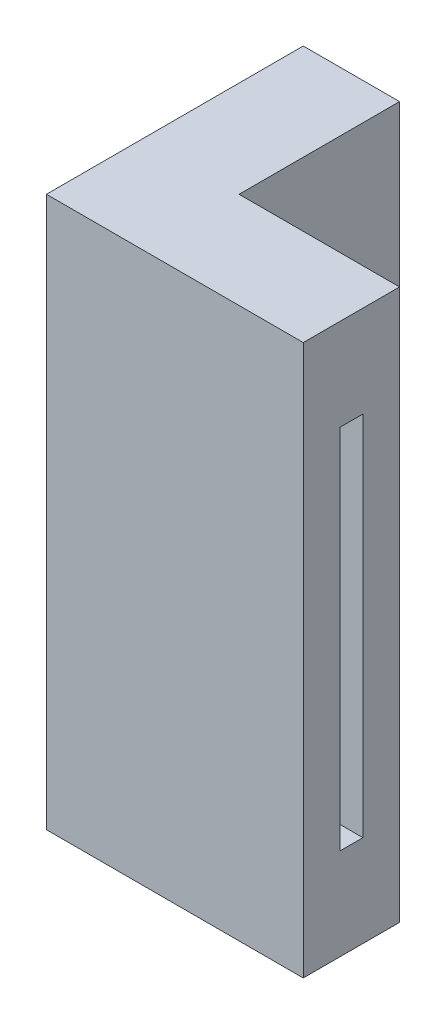
from build123d import *

# Parameters (mm, degrees)
BOSS_EXTRUDE2_DEPTH   = 76.2
BOSS_EXTRUDE2_2_DEPTH = 76.2
BOSS_EXTRUDE3_DEPTH   = 12.7
BOSS_EXTRUDE4_DEPTH   = 12.7
SKETCH3_R             = 2.1
CUT_EXTRUDE1_DEPTH    = 6.35


with BuildPart() as part:
    # Sketch1 → Boss-Extrude2 (new body)
    with BuildSketch(Plane(origin=(0, 0, 0), x_dir=(1, 0, 0), z_dir=(0, 1, 0))):
        Polygon((30.48, 0), (0, 0), (0, 30.48), (-5.08, 30.48), (-5.08, -5.08), (30.48, -5.08), align=None)
    extrude(amount=BOSS_EXTRUDE2_DEPTH)



with BuildPart() as body_2:
    # Sketch1 → Boss-Extrude2 2 (new body)
    with BuildSketch(Plane(origin=(0, 0, 0), x_dir=(1, 0, 0), z_dir=(0, 1, 0))):
        Polygon((8.255, 30.48), (3.175, 30.48), (3.175, 3.175), (30.48, 3.175), (30.48, 8.255), (8.255, 8.255), align=None)
    extrude(amount=BOSS_EXTRUDE2_2_DEPTH)


with BuildPart() as part_1:
    add(part.part)

    add(body_2.part)  # Boss-Extrude3 merges body 2
    # Sketch1<5> → Boss-Extrude3 (add)
    with BuildSketch(Plane(origin=(0, 0, 0), x_dir=(1, 0, 0), z_dir=(0, 1, 0))):
        Polygon((0, 25.4), (0, 0), (25.4, 0), (30.48, 0), (30.48, 3.175), (25.4, 3.175), (3.175, 3.175), (3.175, 25.4), (3.175, 30.48), (0, 30.48), align=None)
    extrude(amount=BOSS_EXTRUDE3_DEPTH)

    # Sketch2 → Boss-Extrude4 (add)
    with BuildSketch(Plane(origin=(0, 76.2, 0), x_dir=(1, 0, 0), z_dir=(0, 1, 0))):
        Polygon((30.48, -5.08), (30.48, 8.255), (8.255, 8.255), (8.255, 30.48), (-5.08, 30.48), (-5.08, -5.08), align=None)
    extrude(amount=-BOSS_EXTRUDE4_DEPTH)

    # Sketch3 → Cut-Extrude1 (cut)
    with BuildSketch(Plane.XZ):
        with Locations((1.5875, -19.3675)):
            Circle(SKETCH3_R)
        with Locations((19.3675, -1.5875)):
            Circle(SKETCH3_R)
    extrude(amount=-CUT_EXTRUDE1_DEPTH, mode=Mode.SUBTRACT)


solid = part_1.part
